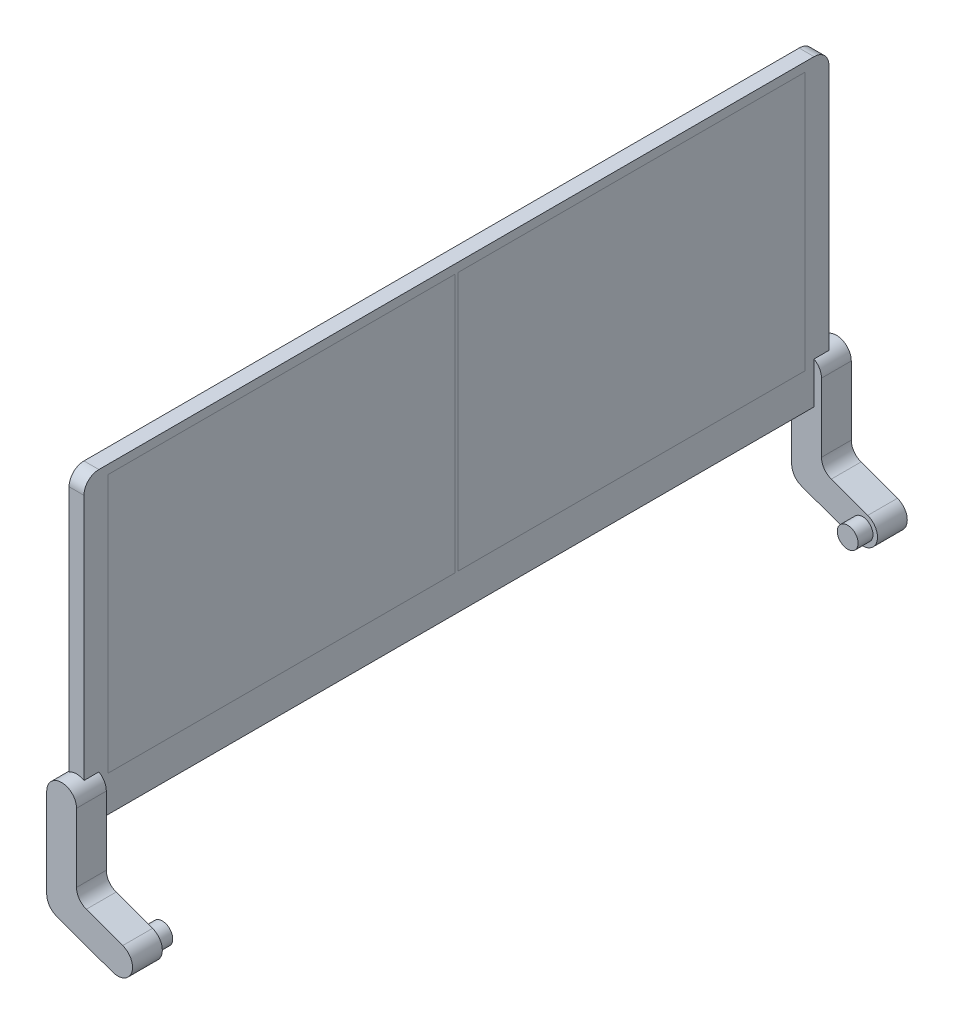
from build123d import *

# Parameters (mm, degrees)
IZIM1_W                       = 112.5
IZIM1_H                       = 82.8
Y_KSEKLIK_EKSTR_ZYON1_DEPTH   = 5
PAH1_SIZE                     = 2
KES_EKSTR_ZYON1_DEPTH         = 270.978221344
Y_KSEKLIK_EKSTR_ZYON2_DEPTH   = 5
IZIM4_R                       = 3.5
Y_KSEKLIK_EKSTR_ZYON3_DEPTH   = 5
IZIM5_W                       = 116.5
IZIM5_H                       = 86.8
Y_KSEKLIK_EKSTR_ZYON4_DEPTH   = 1
Y_KSEKLIK_EKSTR_ZYON4_2_DEPTH = 1


with BuildPart() as part:
    # Çizim1 → Yükseklik-Ekstrüzyon1 (new body)
    with BuildSketch(Plane(origin=(0, 0, 0), x_dir=(0, 0, -1), z_dir=(1, 0, 0))):
        with BuildLine():
            Line((-120, 101.8), (120, 101.8))
            ThreePointArc((120, 101.8), (123.535533906, 100.335533906), (125, 96.8))
            Line((125, 96.8), (125, 0))
            Line((125, 0), (-125, 0))
            Line((-125, 0), (-125, 96.8))
            ThreePointArc((-125, 96.8), (-123.535533906, 100.335533906), (-120, 101.8))
        make_face()
        with Locations((58.75, 55.4)):
            Rectangle(IZIM1_W, IZIM1_H, mode=Mode.SUBTRACT)
        with Locations((-58.75, 55.4)):
            Rectangle(IZIM1_W, IZIM1_H, mode=Mode.SUBTRACT)
    extrude(amount=-Y_KSEKLIK_EKSTR_ZYON1_DEPTH)

    # Pah1
    pah1_edges = [part.edges().sort_by_distance(p)[0] for p in [
        (0, 55.4, 115),
        (0, 14, 58.75),
        (0, 55.4, 2.5),
        (0, 96.8, 58.75),
        (0, 55.4, -115),
        (0, 96.8, -58.75),
        (0, 55.4, -2.5),
        (0, 14, -58.75),
    ]]
    chamfer(pah1_edges, length=PAH1_SIZE)

    # Çizim2 → Kes-Ekstrüzyon1 (cut, through all)
    with BuildSketch(Plane.XY.offset(125)):
        Polygon((-5, 0), (0, 0), (-5, 1.819851171), align=None)
    extrude(amount=-KES_EKSTR_ZYON1_DEPTH, mode=Mode.SUBTRACT)


with BuildPart() as body_2:
    # Çizim3 → Yükseklik-Ekstrüzyon2 (new, symmetric)
    with BuildSketch(Plane.XY.offset(125)):
        with BuildLine():
            Line((-7.5, 9.6), (-7.5, -20.4))
            ThreePointArc((-7.5, -20.4), (-6.595760221, -23.267882182), (-4.210100717, -25.098463104))
            Line((-4.210100717, -25.098463104), (14.583751699, -31.93886597))
            ThreePointArc((14.583751699, -31.93886597), (20.99231552, -28.950503583), (18.003953132, -22.541939763))
            Line((18.003953132, -22.541939763), (5.789899283, -18.096387722))
            ThreePointArc((5.789899283, -18.096387722), (3.404239779, -16.2658068), (2.5, -13.397924618))
            Line((2.5, -13.397924618), (2.5, 9.6))
            ThreePointArc((2.5, 9.6), (-2.5, 14.6), (-7.5, 9.6))
        make_face()
    extrude(amount=Y_KSEKLIK_EKSTR_ZYON2_DEPTH, both=True)

    # Çizim4 → Yükseklik-Ekstrüzyon3 (add)
    with BuildSketch(Plane(origin=(0, 0, 120), x_dir=(-1, 0, 0), z_dir=(0, 0, -1))):
        with Locations((-16.293852416, -27.240402867)):
            Circle(IZIM4_R)
    extrude(amount=Y_KSEKLIK_EKSTR_ZYON3_DEPTH)


with BuildPart() as body_3:
    # Aynalama1: mirrored copy
    add(body_2.part.mirror(Plane.XY))


with BuildPart() as body_4:
    # Çizim5 → Yükseklik-Ekstrüzyon4 (new body)
    with BuildSketch(Plane(origin=(0, 0, 0), x_dir=(0, 0, -1), z_dir=(1, 0, 0))):
        with Locations((58.75, 55.4)):
            Rectangle(IZIM5_W, IZIM5_H)
    extrude(amount=-Y_KSEKLIK_EKSTR_ZYON4_DEPTH)


with BuildPart() as body_5:
    # Çizim5 → Y_kseklik-Ekstr_zyon4 2 (new body)
    with BuildSketch(Plane(origin=(0, 0, 0), x_dir=(0, 0, -1), z_dir=(1, 0, 0))):
        with Locations((-58.75, 55.4)):
            Rectangle(IZIM5_W, IZIM5_H)
    extrude(amount=-Y_KSEKLIK_EKSTR_ZYON4_2_DEPTH)


solid = Compound([part.part, body_2.part, body_3.part, body_4.part, body_5.part])
